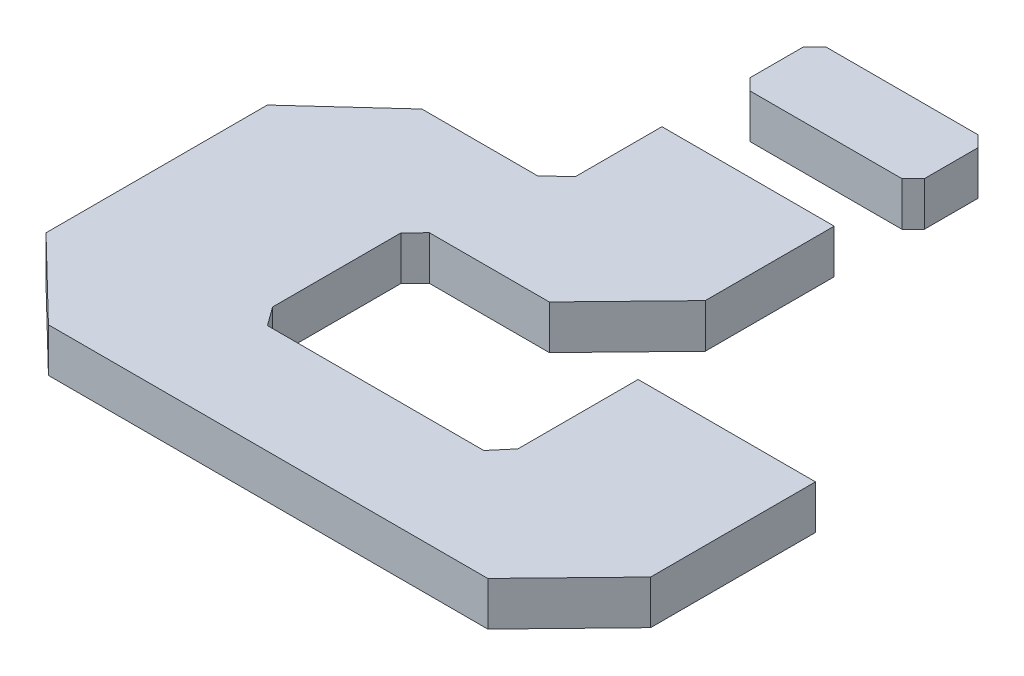
from build123d import *

# Parameters (mm, degrees)
EXTRUDE_1_DEPTH   = 3
EXTRUDE_1_2_DEPTH = 3


with BuildPart() as part:
    # 草图1 → 凸台-拉伸1 (new body)
    with BuildSketch(Plane(origin=(0, 0, 0), x_dir=(1, 0, 0), z_dir=(0, 1, 0))):
        Polygon((25.637552557, -18.985620439), (25.637552557, -7.714616343), (13.5104667, -7.714616343), (13.5104667, -15.937756848), (12.441882902, -17.197566631), (-2.35330466, -17.197566631), (-3.27912841, -15.920718967), (-3.27912841, -7.152500555), (-2.318531745, -6.162085626), (5.886014423, -6.162085626), (11.135743374, -0.749397742), (11.135743374, 8.068150789), (-0.644307785, 8.068150789), (-0.644307785, 2.140146906), (-1.994016853, 0.90675288), (-9.894977458, 0.90675288), (-15.418775569, -4.141016123), (-15.418775569, -19.274774033), (-9.888098832, -24.638939565), (20.154437012, -24.638939565), align=None)
    extrude(amount=EXTRUDE_1_DEPTH)


with BuildPart() as body_2:
    # 草图1 → Extrude 1 2 (new body)
    with BuildSketch(Plane(origin=(0, 0, 0), x_dir=(1, 0, 0), z_dir=(0, 1, 0))):
        Polygon((10.639393218, 13.196544402), (11.405078643, 13.962229827), (11.405078643, 17.630858977), (10.639393218, 18.396544402), (0.234355973, 18.396544402), (-0.531329452, 17.630858977), (-0.531329452, 13.962229827), (0.234355973, 13.196544402), align=None)
    extrude(amount=EXTRUDE_1_2_DEPTH)


solid = Compound([part.part, body_2.part])
